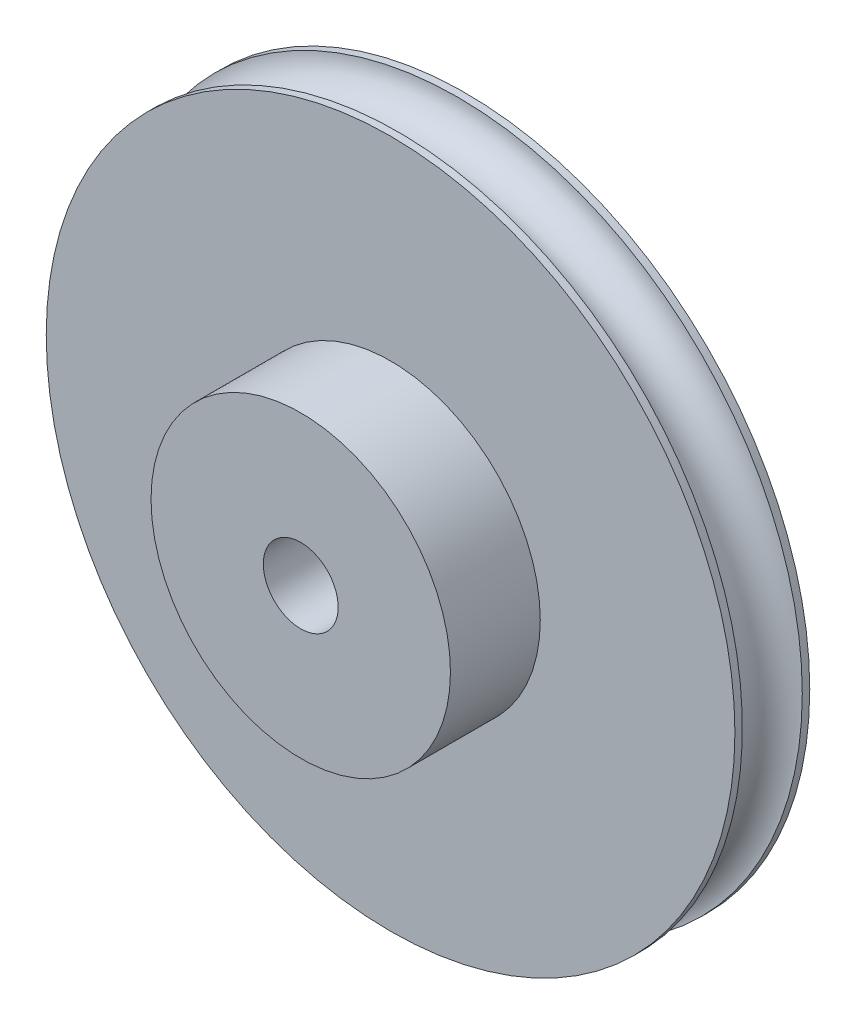
from build123d import *

# Parameters (mm, degrees)
ESQUISSE1_R             = 23
BOSS_EXTRU_1_DEPTH      = 5
ESQUISSE2_R             = 10
BOSS_EXTRU_2_DEPTH      = 6
ESQUISSE3_R             = 2.5
ENL_V_MAT_EXTRU_1_DEPTH = 35.336569427
ESQUISSE4_R             = 2


with BuildPart() as part:
    # Esquisse1 → Boss.-Extru.1 (new body)
    with BuildSketch(Plane.XY):
        Circle(ESQUISSE1_R)
    extrude(amount=BOSS_EXTRU_1_DEPTH)

    # Esquisse2 → Boss.-Extru.2 (add)
    with BuildSketch(Plane.XY.offset(5)):
        Circle(ESQUISSE2_R)
    extrude(amount=BOSS_EXTRU_2_DEPTH)

    # Esquisse3 → Enlèv. mat.-Extru.1 (cut, through all)
    with BuildSketch(Plane.XY.offset(11)):
        Circle(ESQUISSE3_R)
    extrude(amount=-ENL_V_MAT_EXTRU_1_DEPTH, mode=Mode.SUBTRACT)

    # Esquisse4 → Enlèvement de matière-Révolution1 (revolve, cut)
    with BuildSketch(Plane(origin=(0, 0, 0), x_dir=(0, 0, -1), z_dir=(1, 0, 0)), mode=Mode.PRIVATE) as enl_vement_de_mati_re_r_volution1_sk:
        with Locations((-2.5, 23)):
            Circle(ESQUISSE4_R)
    revolve(enl_vement_de_mati_re_r_volution1_sk.sketch.rotate(Axis((0, 0, 0), (0, 0, 1)), 90), axis=Axis((0, 0, 0), (0, 0, 1)), mode=Mode.SUBTRACT)


solid = part.part
